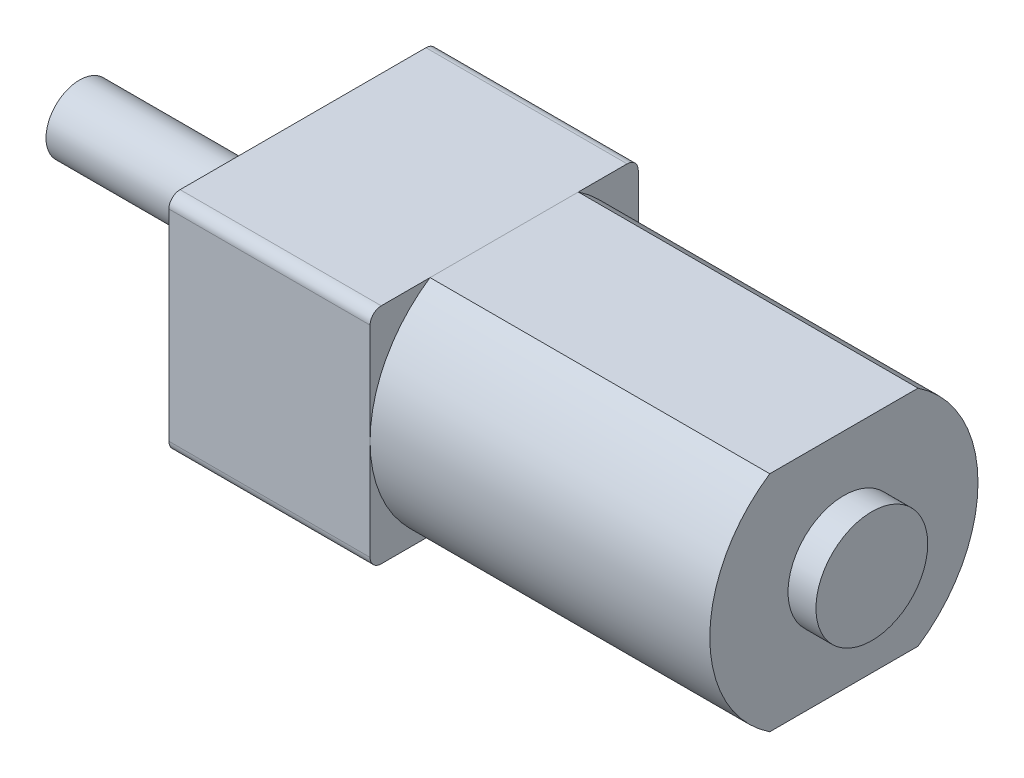
from build123d import *

# Parameters (mm, degrees)
BOSS_EXTRUDE1_DEPTH = 15.2
SKETCH2_R           = 2.5
BOSS_EXTRUDE2_DEPTH = 1.25
SKETCH3_W           = 12
SKETCH3_H           = 10
BOSS_EXTRUDE3_DEPTH = 9
SKETCH4_R           = 2
BOSS_EXTRUDE4_DEPTH = 0.7
BOSS_EXTRUDE5_DEPTH = 9.3
FILLET1_R           = 0.5


with BuildPart() as part:
    # Sketch1 → Boss-Extrude1 (new body)
    with BuildSketch(Plane(origin=(0, 0, 0), x_dir=(0, 0, -1), z_dir=(1, 0, 0))):
        with BuildLine():
            Line((-3.31662479, 5), (3.31662479, 5))
            ThreePointArc((3.31662479, 5), (6, 0), (3.31662479, -5))
            Line((3.31662479, -5), (-3.31662479, -5))
            ThreePointArc((-3.31662479, -5), (-6, 0), (-3.31662479, 5))
        make_face()
    extrude(amount=BOSS_EXTRUDE1_DEPTH)

    # Sketch2 → Boss-Extrude2 (add)
    with BuildSketch(Plane(origin=(15.2, 0, 0), x_dir=(0, 0, -1), z_dir=(1, 0, 0))):
        Circle(SKETCH2_R)
    extrude(amount=BOSS_EXTRUDE2_DEPTH)


with BuildPart() as body_2:
    # Sketch3 → Boss-Extrude3 (new body)
    with BuildSketch(Plane.ZY):
        Rectangle(SKETCH3_W, SKETCH3_H)
    extrude(amount=BOSS_EXTRUDE3_DEPTH)

    # Fillet1
    fillet1_edges = [body_2.edges().sort_by_distance(p)[0] for p in [
        (-4.5, -5, 6),
        (-4.5, -5, -6),
        (-4.5, 5, -6),
        (-4.5, 5, 6),
    ]]
    fillet(fillet1_edges, radius=FILLET1_R)


with BuildPart() as body_3:
    # Sketch4 → Boss-Extrude4 (new body)
    with BuildSketch(Plane.ZY.offset(9)):
        Circle(SKETCH4_R)
    extrude(amount=BOSS_EXTRUDE4_DEPTH)


with BuildPart() as body_4:
    # Sketch5 → Boss-Extrude5 (new body)
    with BuildSketch(Plane.ZY.offset(9.7)):
        with BuildLine():
            Line((-1.118033989, -1), (1.118033989, -1))
            ThreePointArc((1.118033989, -1), (0, 1.5), (-1.118033989, -1))
        make_face()
    extrude(amount=BOSS_EXTRUDE5_DEPTH)


solid = Compound([part.part, body_2.part, body_3.part, body_4.part])
